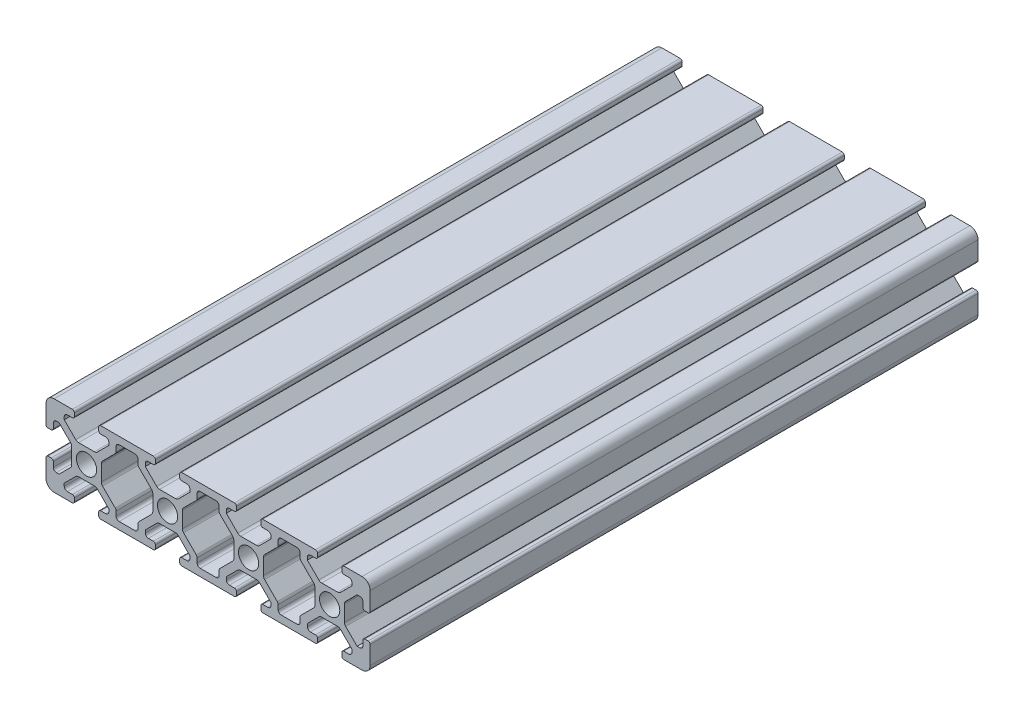
from build123d import *

# Parameters (mm, degrees)
SKETCH1_R           = 2.5
BOSS_EXTRUDE1_DEPTH = 150


with BuildPart() as part:
    # Sketch1 → Boss-Extrude1 (new body)
    with BuildSketch(Plane.XY):
        with BuildLine():
            Line((-41.934956355, 2.341454023), (-37.434956355, 2.341454023))
            ThreePointArc((-37.434956355, 2.341454023), (-37.081402965, 2.487900633), (-36.934956355, 2.841454023))
            Line((-36.934956355, 2.841454023), (-36.934956355, 3.641454023))
            ThreePointArc((-36.934956355, 3.641454023), (-37.081402965, 3.995007414), (-37.434956355, 4.141454023))
            Line((-37.434956355, 4.141454023), (-38.684956355, 4.141454023))
            ThreePointArc((-38.684956355, 4.141454023), (-39.215286441, 4.361123937), (-39.434956355, 4.891454023))
            Line((-39.434956355, 4.891454023), (-39.434956355, 5.568661817))
            Line((-39.434956355, 5.568661817), (-36.605057368, 8.398560804))
            ThreePointArc((-36.605057368, 8.398560804), (-36.280634019, 8.615333556), (-35.897950587, 8.691454023))
            Line((-35.897950587, 8.691454023), (-31.971962124, 8.691454023))
            ThreePointArc((-31.971962124, 8.691454023), (-31.589278691, 8.615333556), (-31.264855343, 8.398560804))
            Line((-31.264855343, 8.398560804), (-28.434956355, 5.568661817))
            Line((-28.434956355, 5.568661817), (-28.434956355, 4.891454023))
            ThreePointArc((-28.434956355, 4.891454023), (-28.654626269, 4.361123937), (-29.184956355, 4.141454023))
            Line((-29.184956355, 4.141454023), (-30.434956355, 4.141454023))
            ThreePointArc((-30.434956355, 4.141454023), (-30.788509746, 3.995007414), (-30.934956355, 3.641454023))
            Line((-30.934956355, 3.641454023), (-30.934956355, 2.841454023))
            ThreePointArc((-30.934956355, 2.841454023), (-30.788509746, 2.487900633), (-30.434956355, 2.341454023))
            Line((-30.434956355, 2.341454023), (-17.434956355, 2.341454023))
            ThreePointArc((-17.434956355, 2.341454023), (-17.081402965, 2.487900633), (-16.934956355, 2.841454023))
            Line((-16.934956355, 2.841454023), (-16.934956355, 3.641454023))
            ThreePointArc((-16.934956355, 3.641454023), (-17.081402965, 3.995007414), (-17.434956355, 4.141454023))
            Line((-17.434956355, 4.141454023), (-18.684956355, 4.141454023))
            ThreePointArc((-18.684956355, 4.141454023), (-19.215286441, 4.361123937), (-19.434956355, 4.891454023))
            Line((-19.434956355, 4.891454023), (-19.434956355, 5.568661817))
            Line((-19.434956355, 5.568661817), (-16.605057368, 8.398560804))
            ThreePointArc((-16.605057368, 8.398560804), (-16.280634019, 8.615333556), (-15.897950587, 8.691454023))
            Line((-15.897950587, 8.691454023), (-11.971962124, 8.691454023))
            ThreePointArc((-11.971962124, 8.691454023), (-11.589278691, 8.615333556), (-11.264855343, 8.398560804))
            Line((-11.264855343, 8.398560804), (-8.434956355, 5.568661817))
            Line((-8.434956355, 5.568661817), (-8.434956355, 4.891454023))
            ThreePointArc((-8.434956355, 4.891454023), (-8.654626269, 4.361123937), (-9.184956355, 4.141454023))
            Line((-9.184956355, 4.141454023), (-10.434956355, 4.141454023))
            ThreePointArc((-10.434956355, 4.141454023), (-10.788509746, 3.995007414), (-10.934956355, 3.641454023))
            Line((-10.934956355, 3.641454023), (-10.934956355, 2.841454023))
            ThreePointArc((-10.934956355, 2.841454023), (-10.788509746, 2.487900633), (-10.434956355, 2.341454023))
            Line((-10.434956355, 2.341454023), (2.565043645, 2.341454023))
            ThreePointArc((2.565043645, 2.341454023), (2.918597035, 2.487900633), (3.065043645, 2.841454023))
            Line((3.065043645, 2.841454023), (3.065043645, 3.641454023))
            ThreePointArc((3.065043645, 3.641454023), (2.918597035, 3.995007414), (2.565043645, 4.141454023))
            Line((2.565043645, 4.141454023), (1.315043645, 4.141454023))
            ThreePointArc((1.315043645, 4.141454023), (0.784713559, 4.361123937), (0.565043645, 4.891454023))
            Line((0.565043645, 4.891454023), (0.565043645, 5.568661817))
            Line((0.565043645, 5.568661817), (3.394942632, 8.398560804))
            ThreePointArc((3.394942632, 8.398560804), (3.719365981, 8.615333556), (4.102049413, 8.691454023))
            Line((4.102049413, 8.691454023), (8.028037876, 8.691454023))
            ThreePointArc((8.028037876, 8.691454023), (8.410721309, 8.615333556), (8.735144657, 8.398560804))
            Line((8.735144657, 8.398560804), (11.565043645, 5.568661817))
            Line((11.565043645, 5.568661817), (11.565043645, 4.891454023))
            ThreePointArc((11.565043645, 4.891454023), (11.345373731, 4.361123937), (10.815043645, 4.141454023))
            Line((10.815043645, 4.141454023), (9.565043645, 4.141454023))
            ThreePointArc((9.565043645, 4.141454023), (9.211490254, 3.995007414), (9.065043645, 3.641454023))
            Line((9.065043645, 3.641454023), (9.065043645, 2.841454023))
            ThreePointArc((9.065043645, 2.841454023), (9.211490254, 2.487900633), (9.565043645, 2.341454023))
            Line((9.565043645, 2.341454023), (22.565043645, 2.341454023))
            ThreePointArc((22.565043645, 2.341454023), (22.918597035, 2.487900633), (23.065043645, 2.841454023))
            Line((23.065043645, 2.841454023), (23.065043645, 3.641454023))
            ThreePointArc((23.065043645, 3.641454023), (22.918597035, 3.995007414), (22.565043645, 4.141454023))
            Line((22.565043645, 4.141454023), (21.315043645, 4.141454023))
            ThreePointArc((21.315043645, 4.141454023), (20.784713559, 4.361123937), (20.565043645, 4.891454023))
            Line((20.565043645, 4.891454023), (20.565043645, 5.568661817))
            Line((20.565043645, 5.568661817), (23.394942632, 8.398560804))
            ThreePointArc((23.394942632, 8.398560804), (23.719365981, 8.615333556), (24.102049413, 8.691454023))
            Line((24.102049413, 8.691454023), (28.028037876, 8.691454023))
            ThreePointArc((28.028037876, 8.691454023), (28.410721309, 8.615333556), (28.735144657, 8.398560804))
            Line((28.735144657, 8.398560804), (31.565043645, 5.568661817))
            Line((31.565043645, 5.568661817), (31.565043645, 4.891454023))
            ThreePointArc((31.565043645, 4.891454023), (31.345373731, 4.361123937), (30.815043645, 4.141454023))
            Line((30.815043645, 4.141454023), (29.565043645, 4.141454023))
            ThreePointArc((29.565043645, 4.141454023), (29.211490254, 3.995007414), (29.065043645, 3.641454023))
            Line((29.065043645, 3.641454023), (29.065043645, 2.841454023))
            ThreePointArc((29.065043645, 2.841454023), (29.211490254, 2.487900633), (29.565043645, 2.341454023))
            Line((29.565043645, 2.341454023), (34.065043645, 2.341454023))
            ThreePointArc((34.065043645, 2.341454023), (35.479257207, 2.927240461), (36.065043645, 4.341454023))
            Line((36.065043645, 4.341454023), (36.065043645, 8.841454023))
            ThreePointArc((36.065043645, 8.841454023), (35.918597035, 9.195007414), (35.565043645, 9.341454023))
            Line((35.565043645, 9.341454023), (34.765043645, 9.341454023))
            ThreePointArc((34.765043645, 9.341454023), (34.411490254, 9.195007414), (34.265043645, 8.841454023))
            Line((34.265043645, 8.841454023), (34.265043645, 7.591454023))
            ThreePointArc((34.265043645, 7.591454023), (34.045373731, 7.061123937), (33.515043645, 6.841454023))
            Line((33.515043645, 6.841454023), (32.837835851, 6.841454023))
            Line((32.837835851, 6.841454023), (30.007936864, 9.671353011))
            ThreePointArc((30.007936864, 9.671353011), (29.791164112, 9.995776359), (29.715043645, 10.378459792))
            Line((29.715043645, 10.378459792), (29.715043645, 14.304448255))
            ThreePointArc((29.715043645, 14.304448255), (29.791164112, 14.687131687), (30.007936864, 15.011555036))
            Line((30.007936864, 15.011555036), (32.837835851, 17.841454023))
            Line((32.837835851, 17.841454023), (33.515043645, 17.841454023))
            ThreePointArc((33.515043645, 17.841454023), (34.045373731, 17.621784109), (34.265043645, 17.091454023))
            Line((34.265043645, 17.091454023), (34.265043645, 15.841454023))
            ThreePointArc((34.265043645, 15.841454023), (34.411490254, 15.487900633), (34.765043645, 15.341454023))
            Line((34.765043645, 15.341454023), (35.565043645, 15.341454023))
            ThreePointArc((35.565043645, 15.341454023), (35.918597035, 15.487900633), (36.065043645, 15.841454023))
            Line((36.065043645, 15.841454023), (36.065043645, 20.341454023))
            ThreePointArc((36.065043645, 20.341454023), (35.479257207, 21.755667586), (34.065043645, 22.341454023))
            Line((34.065043645, 22.341454023), (29.565043645, 22.341454023))
            ThreePointArc((29.565043645, 22.341454023), (29.211490254, 22.195007414), (29.065043645, 21.841454023))
            Line((29.065043645, 21.841454023), (29.065043645, 21.041454023))
            ThreePointArc((29.065043645, 21.041454023), (29.211490254, 20.687900633), (29.565043645, 20.541454023))
            Line((29.565043645, 20.541454023), (30.815043645, 20.541454023))
            ThreePointArc((30.815043645, 20.541454023), (31.345373731, 20.321784109), (31.565043645, 19.791454023))
            Line((31.565043645, 19.791454023), (31.565043645, 19.114246229))
            Line((31.565043645, 19.114246229), (28.735144657, 16.284347242))
            ThreePointArc((28.735144657, 16.284347242), (28.410721309, 16.067574491), (28.028037876, 15.991454023))
            Line((28.028037876, 15.991454023), (24.102049413, 15.991454023))
            ThreePointArc((24.102049413, 15.991454023), (23.719365981, 16.067574491), (23.394942632, 16.284347242))
            Line((23.394942632, 16.284347242), (20.565043645, 19.114246229))
            Line((20.565043645, 19.114246229), (20.565043645, 19.791454023))
            ThreePointArc((20.565043645, 19.791454023), (20.784713559, 20.321784109), (21.315043645, 20.541454023))
            Line((21.315043645, 20.541454023), (22.565043645, 20.541454023))
            ThreePointArc((22.565043645, 20.541454023), (22.918597035, 20.687900633), (23.065043645, 21.041454023))
            Line((23.065043645, 21.041454023), (23.065043645, 21.841454023))
            ThreePointArc((23.065043645, 21.841454023), (22.918597035, 22.195007414), (22.565043645, 22.341454023))
            Line((22.565043645, 22.341454023), (9.565043645, 22.341454023))
            ThreePointArc((9.565043645, 22.341454023), (9.211490254, 22.195007414), (9.065043645, 21.841454023))
            Line((9.065043645, 21.841454023), (9.065043645, 21.041454023))
            ThreePointArc((9.065043645, 21.041454023), (9.211490254, 20.687900633), (9.565043645, 20.541454023))
            Line((9.565043645, 20.541454023), (10.815043645, 20.541454023))
            ThreePointArc((10.815043645, 20.541454023), (11.345373731, 20.321784109), (11.565043645, 19.791454023))
            Line((11.565043645, 19.791454023), (11.565043645, 19.114246229))
            Line((11.565043645, 19.114246229), (8.735144657, 16.284347242))
            ThreePointArc((8.735144657, 16.284347242), (8.410721309, 16.067574491), (8.028037876, 15.991454023))
            Line((8.028037876, 15.991454023), (4.102049413, 15.991454023))
            ThreePointArc((4.102049413, 15.991454023), (3.719365981, 16.067574491), (3.394942632, 16.284347242))
            Line((3.394942632, 16.284347242), (0.565043645, 19.114246229))
            Line((0.565043645, 19.114246229), (0.565043645, 19.791454023))
            ThreePointArc((0.565043645, 19.791454023), (0.784713559, 20.321784109), (1.315043645, 20.541454023))
            Line((1.315043645, 20.541454023), (2.565043645, 20.541454023))
            ThreePointArc((2.565043645, 20.541454023), (2.918597035, 20.687900633), (3.065043645, 21.041454023))
            Line((3.065043645, 21.041454023), (3.065043645, 21.841454023))
            ThreePointArc((3.065043645, 21.841454023), (2.918597035, 22.195007414), (2.565043645, 22.341454023))
            Line((2.565043645, 22.341454023), (-10.434956355, 22.341454023))
            ThreePointArc((-10.434956355, 22.341454023), (-10.788509746, 22.195007414), (-10.934956355, 21.841454023))
            Line((-10.934956355, 21.841454023), (-10.934956355, 21.041454023))
            ThreePointArc((-10.934956355, 21.041454023), (-10.788509746, 20.687900633), (-10.434956355, 20.541454023))
            Line((-10.434956355, 20.541454023), (-9.184956355, 20.541454023))
            ThreePointArc((-9.184956355, 20.541454023), (-8.654626269, 20.321784109), (-8.434956355, 19.791454023))
            Line((-8.434956355, 19.791454023), (-8.434956355, 19.114246229))
            Line((-8.434956355, 19.114246229), (-11.264855343, 16.284347242))
            ThreePointArc((-11.264855343, 16.284347242), (-11.589278691, 16.067574491), (-11.971962124, 15.991454023))
            Line((-11.971962124, 15.991454023), (-15.897950587, 15.991454023))
            ThreePointArc((-15.897950587, 15.991454023), (-16.280634019, 16.067574491), (-16.605057368, 16.284347242))
            Line((-16.605057368, 16.284347242), (-19.434956355, 19.114246229))
            Line((-19.434956355, 19.114246229), (-19.434956355, 19.791454023))
            ThreePointArc((-19.434956355, 19.791454023), (-19.215286441, 20.321784109), (-18.684956355, 20.541454023))
            Line((-18.684956355, 20.541454023), (-17.434956355, 20.541454023))
            ThreePointArc((-17.434956355, 20.541454023), (-17.081402965, 20.687900633), (-16.934956355, 21.041454023))
            Line((-16.934956355, 21.041454023), (-16.934956355, 21.841454023))
            ThreePointArc((-16.934956355, 21.841454023), (-17.081402965, 22.195007414), (-17.434956355, 22.341454023))
            Line((-17.434956355, 22.341454023), (-30.434956355, 22.341454023))
            ThreePointArc((-30.434956355, 22.341454023), (-30.788509746, 22.195007414), (-30.934956355, 21.841454023))
            Line((-30.934956355, 21.841454023), (-30.934956355, 21.041454023))
            ThreePointArc((-30.934956355, 21.041454023), (-30.788509746, 20.687900633), (-30.434956355, 20.541454023))
            Line((-30.434956355, 20.541454023), (-29.184956355, 20.541454023))
            ThreePointArc((-29.184956355, 20.541454023), (-28.654626269, 20.321784109), (-28.434956355, 19.791454023))
            Line((-28.434956355, 19.791454023), (-28.434956355, 19.114246229))
            Line((-28.434956355, 19.114246229), (-31.264855343, 16.284347242))
            ThreePointArc((-31.264855343, 16.284347242), (-31.589278691, 16.067574491), (-31.971962124, 15.991454023))
            Line((-31.971962124, 15.991454023), (-35.897950587, 15.991454023))
            ThreePointArc((-35.897950587, 15.991454023), (-36.280634019, 16.067574491), (-36.605057368, 16.284347242))
            Line((-36.605057368, 16.284347242), (-39.434956355, 19.114246229))
            Line((-39.434956355, 19.114246229), (-39.434956355, 19.791454023))
            ThreePointArc((-39.434956355, 19.791454023), (-39.215286441, 20.321784109), (-38.684956355, 20.541454023))
            Line((-38.684956355, 20.541454023), (-37.434956355, 20.541454023))
            ThreePointArc((-37.434956355, 20.541454023), (-37.081402965, 20.687900633), (-36.934956355, 21.041454023))
            Line((-36.934956355, 21.041454023), (-36.934956355, 21.841454023))
            ThreePointArc((-36.934956355, 21.841454023), (-37.081402965, 22.195007414), (-37.434956355, 22.341454023))
            Line((-37.434956355, 22.341454023), (-41.934956355, 22.341454023))
            ThreePointArc((-41.934956355, 22.341454023), (-43.349169918, 21.755667586), (-43.934956355, 20.341454023))
            Line((-43.934956355, 20.341454023), (-43.934956355, 15.841454023))
            ThreePointArc((-43.934956355, 15.841454023), (-43.788509746, 15.487900633), (-43.434956355, 15.341454023))
            Line((-43.434956355, 15.341454023), (-42.634956355, 15.341454023))
            ThreePointArc((-42.634956355, 15.341454023), (-42.281402965, 15.487900633), (-42.134956355, 15.841454023))
            Line((-42.134956355, 15.841454023), (-42.134956355, 17.091454023))
            ThreePointArc((-42.134956355, 17.091454023), (-41.915286441, 17.621784109), (-41.384956355, 17.841454023))
            Line((-41.384956355, 17.841454023), (-40.707748561, 17.841454023))
            Line((-40.707748561, 17.841454023), (-37.877849574, 15.011555036))
            ThreePointArc((-37.877849574, 15.011555036), (-37.661076823, 14.687131687), (-37.584956355, 14.304448255))
            Line((-37.584956355, 14.304448255), (-37.584956355, 10.378459792))
            ThreePointArc((-37.584956355, 10.378459792), (-37.661076823, 9.995776359), (-37.877849574, 9.671353011))
            Line((-37.877849574, 9.671353011), (-40.707748561, 6.841454023))
            Line((-40.707748561, 6.841454023), (-41.384956355, 6.841454023))
            ThreePointArc((-41.384956355, 6.841454023), (-41.915286441, 7.061123937), (-42.134956355, 7.591454023))
            Line((-42.134956355, 7.591454023), (-42.134956355, 8.841454023))
            ThreePointArc((-42.134956355, 8.841454023), (-42.281402965, 9.195007414), (-42.634956355, 9.341454023))
            Line((-42.634956355, 9.341454023), (-43.434956355, 9.341454023))
            ThreePointArc((-43.434956355, 9.341454023), (-43.788509746, 9.195007414), (-43.934956355, 8.841454023))
            Line((-43.934956355, 8.841454023), (-43.934956355, 4.341454023))
            ThreePointArc((-43.934956355, 4.341454023), (-43.349169918, 2.927240461), (-41.934956355, 2.341454023))
        make_face()
        with Locations((-33.934956355, 12.341454023)):
            Circle(SKETCH1_R, mode=Mode.SUBTRACT)
        with Locations((-13.934956355, 12.341454023)):
            Circle(SKETCH1_R, mode=Mode.SUBTRACT)
        with Locations((6.065043645, 12.341454023)):
            Circle(SKETCH1_R, mode=Mode.SUBTRACT)
        with Locations((26.065043645, 12.341454023)):
            Circle(SKETCH1_R, mode=Mode.SUBTRACT)
        with BuildLine():
            Line((-9.992063136, 15.011555036), (-6.854626269, 18.148991903))
            ThreePointArc((-6.854626269, 18.148991903), (-6.692046706, 18.392309415), (-6.634956355, 18.679321989))
            Line((-6.634956355, 18.679321989), (-6.634956355, 19.791454023))
            ThreePointArc((-6.634956355, 19.791454023), (-6.415286441, 20.321784109), (-5.884956355, 20.541454023))
            Line((-5.884956355, 20.541454023), (-1.984956355, 20.541454023))
            ThreePointArc((-1.984956355, 20.541454023), (-1.454626269, 20.321784109), (-1.234956355, 19.791454023))
            Line((-1.234956355, 19.791454023), (-1.234956355, 18.679321989))
            ThreePointArc((-1.234956355, 18.679321989), (-1.177866005, 18.392309415), (-1.015286441, 18.148991903))
            Line((-1.015286441, 18.148991903), (2.122150426, 15.011555036))
            ThreePointArc((2.122150426, 15.011555036), (2.338923177, 14.687131687), (2.415043645, 14.304448255))
            Line((2.415043645, 14.304448255), (2.415043645, 10.378459792))
            ThreePointArc((2.415043645, 10.378459792), (2.338923177, 9.995776359), (2.122150426, 9.671353011))
            Line((2.122150426, 9.671353011), (-1.015286441, 6.533916144))
            ThreePointArc((-1.015286441, 6.533916144), (-1.177866005, 6.290598632), (-1.234956355, 6.003586058))
            Line((-1.234956355, 6.003586058), (-1.234956355, 4.891454023))
            ThreePointArc((-1.234956355, 4.891454023), (-1.454626269, 4.361123937), (-1.984956355, 4.141454023))
            Line((-1.984956355, 4.141454023), (-5.884956355, 4.141454023))
            ThreePointArc((-5.884956355, 4.141454023), (-6.415286441, 4.361123937), (-6.634956355, 4.891454023))
            Line((-6.634956355, 4.891454023), (-6.634956355, 6.003586058))
            ThreePointArc((-6.634956355, 6.003586058), (-6.692046706, 6.290598632), (-6.854626269, 6.533916144))
            Line((-6.854626269, 6.533916144), (-9.992063136, 9.671353011))
            ThreePointArc((-9.992063136, 9.671353011), (-10.208835888, 9.995776359), (-10.284956355, 10.378459792))
            Line((-10.284956355, 10.378459792), (-10.284956355, 14.304448255))
            ThreePointArc((-10.284956355, 14.304448255), (-10.208835888, 14.687131687), (-9.992063136, 15.011555036))
        make_face(mode=Mode.SUBTRACT)
        with BuildLine():
            Line((-21.015286441, 18.148991903), (-17.877849574, 15.011555036))
            ThreePointArc((-17.877849574, 15.011555036), (-17.661076823, 14.687131687), (-17.584956355, 14.304448255))
            Line((-17.584956355, 14.304448255), (-17.584956355, 10.378459792))
            ThreePointArc((-17.584956355, 10.378459792), (-17.661076823, 9.995776359), (-17.877849574, 9.671353011))
            Line((-17.877849574, 9.671353011), (-21.015286441, 6.533916144))
            ThreePointArc((-21.015286441, 6.533916144), (-21.177866005, 6.290598632), (-21.234956355, 6.003586058))
            Line((-21.234956355, 6.003586058), (-21.234956355, 4.891454023))
            ThreePointArc((-21.234956355, 4.891454023), (-21.454626269, 4.361123937), (-21.984956355, 4.141454023))
            Line((-21.984956355, 4.141454023), (-25.884956355, 4.141454023))
            ThreePointArc((-25.884956355, 4.141454023), (-26.415286441, 4.361123937), (-26.634956355, 4.891454023))
            Line((-26.634956355, 4.891454023), (-26.634956355, 6.003586058))
            ThreePointArc((-26.634956355, 6.003586058), (-26.692046706, 6.290598632), (-26.854626269, 6.533916144))
            Line((-26.854626269, 6.533916144), (-29.992063136, 9.671353011))
            ThreePointArc((-29.992063136, 9.671353011), (-30.208835888, 9.995776359), (-30.284956355, 10.378459792))
            Line((-30.284956355, 10.378459792), (-30.284956355, 14.304448255))
            ThreePointArc((-30.284956355, 14.304448255), (-30.208835888, 14.687131687), (-29.992063136, 15.011555036))
            Line((-29.992063136, 15.011555036), (-26.854626269, 18.148991903))
            ThreePointArc((-26.854626269, 18.148991903), (-26.692046706, 18.392309415), (-26.634956355, 18.679321989))
            Line((-26.634956355, 18.679321989), (-26.634956355, 19.791454023))
            ThreePointArc((-26.634956355, 19.791454023), (-26.415286441, 20.321784109), (-25.884956355, 20.541454023))
            Line((-25.884956355, 20.541454023), (-21.984956355, 20.541454023))
            ThreePointArc((-21.984956355, 20.541454023), (-21.454626269, 20.321784109), (-21.234956355, 19.791454023))
            Line((-21.234956355, 19.791454023), (-21.234956355, 18.679321989))
            ThreePointArc((-21.234956355, 18.679321989), (-21.177866005, 18.392309415), (-21.015286441, 18.148991903))
        make_face(mode=Mode.SUBTRACT)
        with BuildLine():
            Line((18.984713559, 18.148991903), (22.122150426, 15.011555036))
            ThreePointArc((22.122150426, 15.011555036), (22.338923177, 14.687131687), (22.415043645, 14.304448255))
            Line((22.415043645, 14.304448255), (22.415043645, 10.378459792))
            ThreePointArc((22.415043645, 10.378459792), (22.338923177, 9.995776359), (22.122150426, 9.671353011))
            Line((22.122150426, 9.671353011), (18.984713559, 6.533916144))
            ThreePointArc((18.984713559, 6.533916144), (18.822133995, 6.290598632), (18.765043645, 6.003586058))
            Line((18.765043645, 6.003586058), (18.765043645, 4.891454023))
            ThreePointArc((18.765043645, 4.891454023), (18.545373731, 4.361123937), (18.015043645, 4.141454023))
            Line((18.015043645, 4.141454023), (14.115043645, 4.141454023))
            ThreePointArc((14.115043645, 4.141454023), (13.584713559, 4.361123937), (13.365043645, 4.891454023))
            Line((13.365043645, 4.891454023), (13.365043645, 6.003586058))
            ThreePointArc((13.365043645, 6.003586058), (13.307953294, 6.290598632), (13.145373731, 6.533916144))
            Line((13.145373731, 6.533916144), (10.007936864, 9.671353011))
            ThreePointArc((10.007936864, 9.671353011), (9.791164112, 9.995776359), (9.715043645, 10.378459792))
            Line((9.715043645, 10.378459792), (9.715043645, 14.304448255))
            ThreePointArc((9.715043645, 14.304448255), (9.791164112, 14.687131687), (10.007936864, 15.011555036))
            Line((10.007936864, 15.011555036), (13.145373731, 18.148991903))
            ThreePointArc((13.145373731, 18.148991903), (13.307953294, 18.392309415), (13.365043645, 18.679321989))
            Line((13.365043645, 18.679321989), (13.365043645, 19.791454023))
            ThreePointArc((13.365043645, 19.791454023), (13.584713559, 20.321784109), (14.115043645, 20.541454023))
            Line((14.115043645, 20.541454023), (18.015043645, 20.541454023))
            ThreePointArc((18.015043645, 20.541454023), (18.545373731, 20.321784109), (18.765043645, 19.791454023))
            Line((18.765043645, 19.791454023), (18.765043645, 18.679321989))
            ThreePointArc((18.765043645, 18.679321989), (18.822133995, 18.392309415), (18.984713559, 18.148991903))
        make_face(mode=Mode.SUBTRACT)
    extrude(amount=BOSS_EXTRUDE1_DEPTH)


solid = part.part
